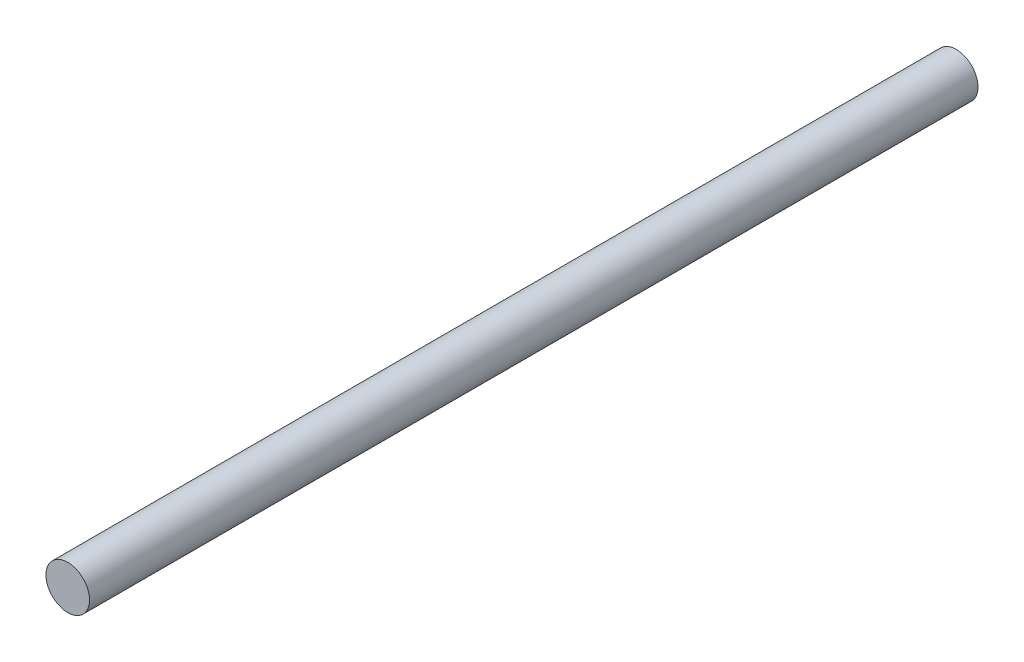
from build123d import *

# Parameters (mm, degrees)
SKETCH_1_R      = 6
EXTRUDE_1_DEPTH = 122.3


with BuildPart() as part:
    # Эскиз1 → Бобышка-Вытянуть1 (new body)
    with BuildSketch(Plane.XY):
        Circle(SKETCH_1_R)
    extrude(amount=EXTRUDE_1_DEPTH)

    # Зеркальное отражение1: part across plane


with BuildPart() as part_1:
    add(part.part)
    add(part.part.mirror(Plane.XY))


solid = part_1.part
